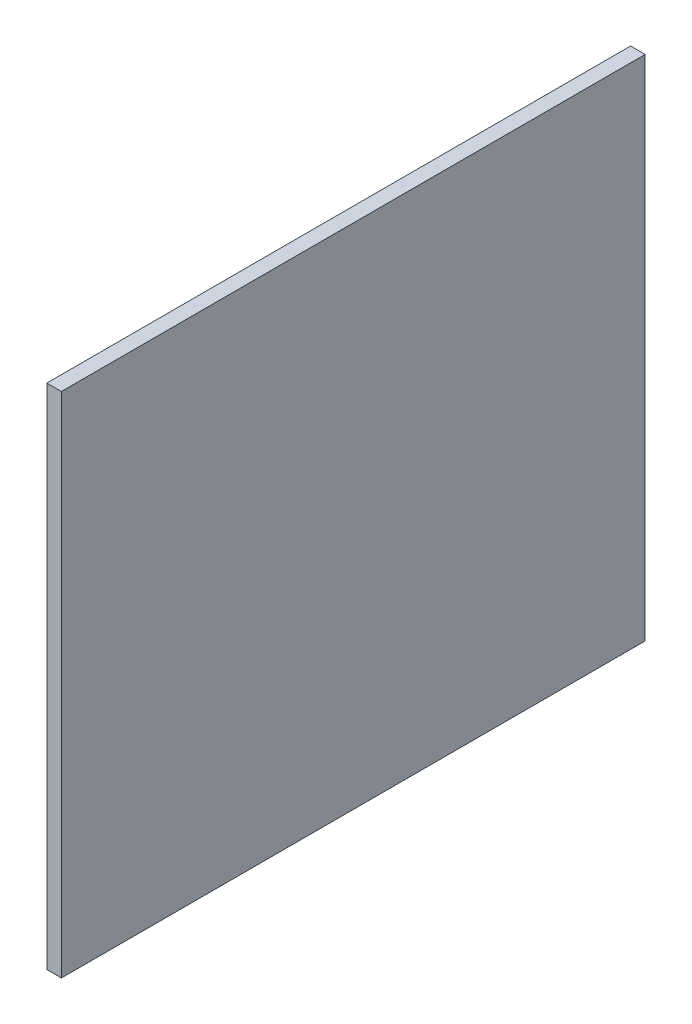
from build123d import *

# Parameters (mm, degrees)
SKETCH1_W           = 1000
SKETCH1_H           = 870
BOSS_EXTRUDE1_DEPTH = 25


with BuildPart() as part:
    # Sketch1 → Boss-Extrude1 (new body)
    with BuildSketch(Plane(origin=(0, 0, 0), x_dir=(0, 0, -1), z_dir=(1, 0, 0))):
        with Locations((500, 435)):
            Rectangle(SKETCH1_W, SKETCH1_H)
    extrude(amount=BOSS_EXTRUDE1_DEPTH)


solid = part.part
